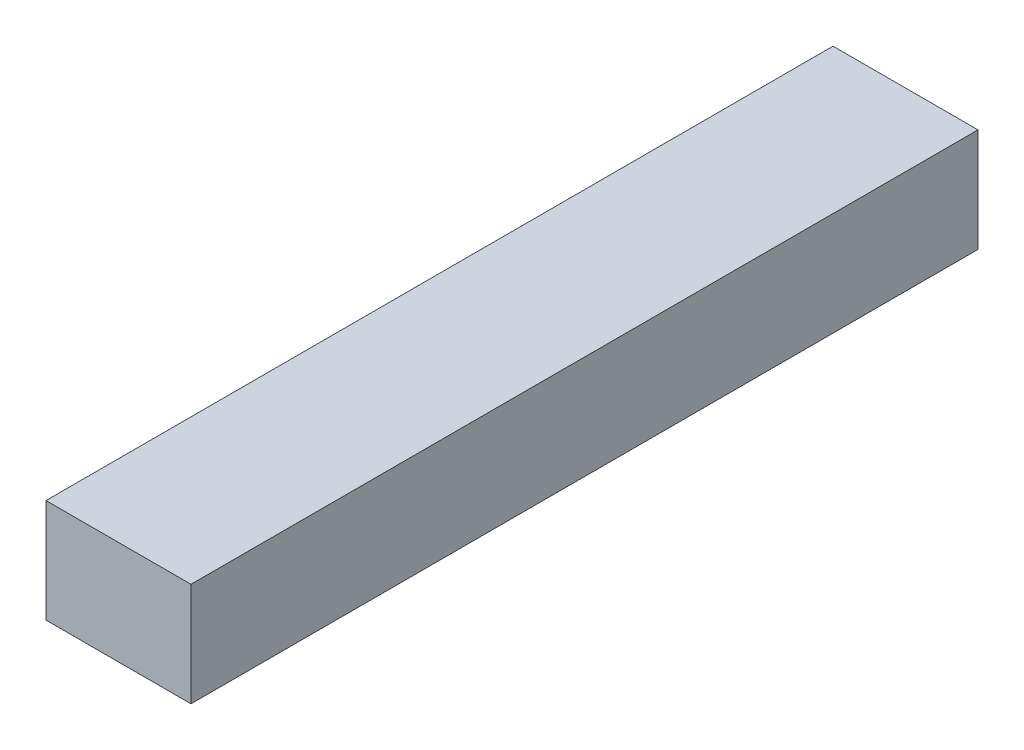
from build123d import *

# Parameters (mm, degrees)
SKETCH1_W           = 14
SKETCH1_H           = 10
BOSS_EXTRUDE1_DEPTH = 38


with BuildPart() as part:
    # Sketch1 → Boss-Extrude1 (new, symmetric)
    with BuildSketch(Plane.XY):
        Rectangle(SKETCH1_W, SKETCH1_H)
    extrude(amount=BOSS_EXTRUDE1_DEPTH, both=True)


solid = part.part
